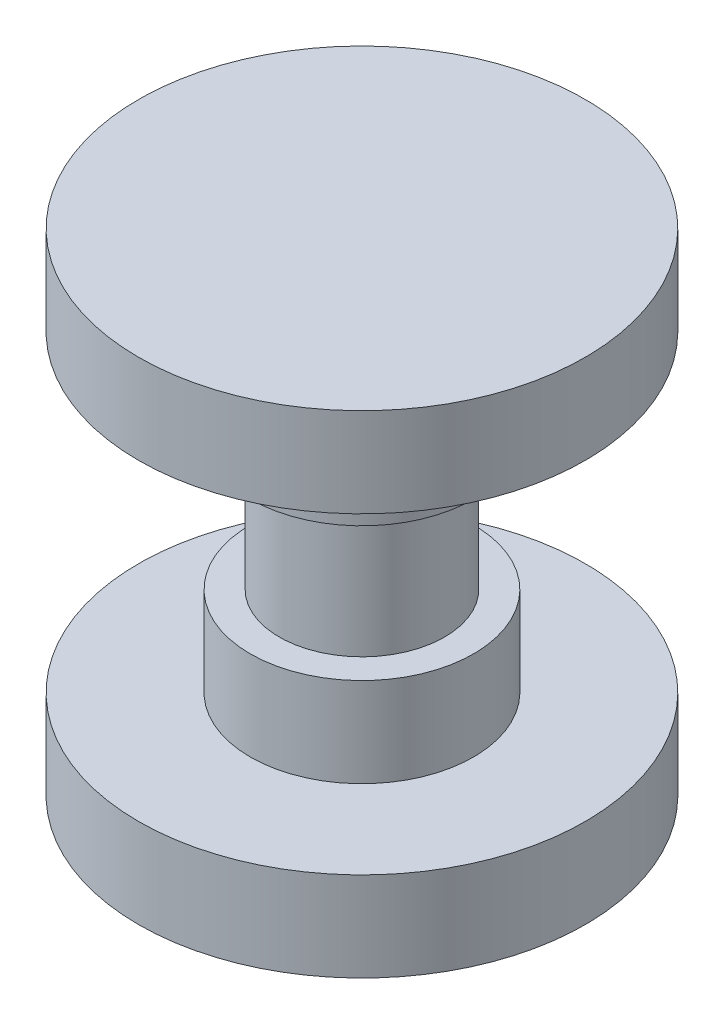
from build123d import *

# Parameters (mm, degrees)
SKETCH1_R           = 31.75
BOSS_EXTRUDE1_DEPTH = 12.7
SKETCH2_R           = 15.875
BOSS_EXTRUDE2_DEPTH = 12.7
SKETCH4_R           = 11.7475
BOSS_EXTRUDE4_DEPTH = 19.05
SKETCH5_R           = 15.875
BOSS_EXTRUDE5_DEPTH = 12.7
SKETCH6_R           = 31.75
BOSS_EXTRUDE6_DEPTH = 12.7


with BuildPart() as part:
    # Sketch1 → Boss-Extrude1 (new body)
    with BuildSketch(Plane(origin=(0, 0, 0), x_dir=(1, 0, 0), z_dir=(0, 1, 0))):
        with Locations(Location((0, 0, 0), (0, 0, 270))):
            Circle(SKETCH1_R)
    extrude(amount=BOSS_EXTRUDE1_DEPTH)

    # Sketch2 → Boss-Extrude2 (add)
    with BuildSketch(Plane(origin=(0, 12.7, 0), x_dir=(1, 0, 0), z_dir=(0, 1, 0))):
        with Locations(Location((0, 0, 0), (0, 0, 270))):
            Circle(SKETCH2_R)
    extrude(amount=BOSS_EXTRUDE2_DEPTH)

    # Sketch4 → Boss-Extrude4 (add)
    with BuildSketch(Plane(origin=(0, 25.4, 0), x_dir=(1, 0, 0), z_dir=(0, 1, 0))):
        with Locations(Location((0, 0, 0), (0, 0, 90))):
            Circle(SKETCH4_R)
    extrude(amount=BOSS_EXTRUDE4_DEPTH)

    # Sketch5 → Boss-Extrude5 (add)
    with BuildSketch(Plane(origin=(0, 44.45, 0), x_dir=(1, 0, 0), z_dir=(0, 1, 0))):
        with Locations(Location((0, 0, 0), (0, 0, 270))):
            Circle(SKETCH5_R)
    extrude(amount=BOSS_EXTRUDE5_DEPTH)

    # Sketch6 → Boss-Extrude6 (add)
    with BuildSketch(Plane(origin=(0, 57.15, 0), x_dir=(1, 0, 0), z_dir=(0, 1, 0))):
        with Locations(Location((0, 0, 0), (0, 0, 270))):
            Circle(SKETCH6_R)
    extrude(amount=BOSS_EXTRUDE6_DEPTH)


solid = part.part
